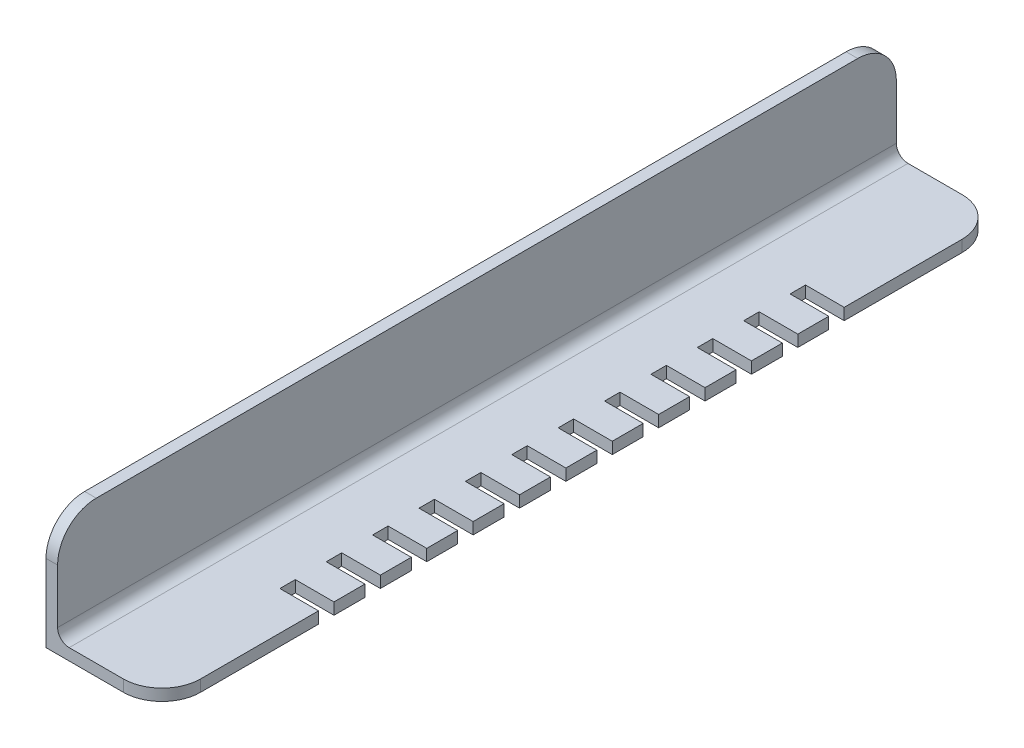
from build123d import *

# Parameters (mm, degrees)
EXTRUDE_1_DEPTH            = 217
FILLET_1_R                 = 20
SKETCH_4_W                 = 20
SKETCH_4_H                 = 8
CUT_EXTRUDE_3_DEPTH        = 10
PATTERN_LINEAR_1_COUNT     = 6
PATTERN_LINEAR_1_PITCH     = 24
PATTERN_LINEAR_1_COL_COUNT = 7
PATTERN_LINEAR_1_COL_PITCH = 24
FILLET_2_R                 = 6


with BuildPart() as part:
    # Эскиз1 → Бобышка-Вытянуть1 (new, symmetric)
    with BuildSketch(Plane.XY):
        Polygon((0, 0), (60, 0), (60, 6), (6, 6), (6, 60), (0, 60), align=None)
    extrude(amount=EXTRUDE_1_DEPTH, both=True)

    # Скругление1
    fillet_1_edges = [part.edges().sort_by_distance(p)[0] for p in [
        (60, 3, 217),
        (3, 60, 217),
        (3, 60, -217),
        (60, 3, -217),
    ]]
    fillet(fillet_1_edges, radius=FILLET_1_R)

    # Эскиз4 → Вырез-Вытянуть3 (cut)
    with BuildSketch(Plane(origin=(0, 0, 0), x_dir=(-1, 0, 0), z_dir=(0, -1, 0))):
        with Locations((-50, -12)):
            Rectangle(SKETCH_4_W, SKETCH_4_H)
    cut_extrude_3 = extrude(amount=-CUT_EXTRUDE_3_DEPTH, mode=Mode.SUBTRACT)

    # Линейный массив1: Вырез-Вытянуть3 ×6
    with Locations(*[(0, 0, i * PATTERN_LINEAR_1_PITCH) for i in range(1, PATTERN_LINEAR_1_COUNT)]):
        add(cut_extrude_3, mode=Mode.SUBTRACT)

    # Линейный массив1 col: Вырез-Вытянуть3 ×7
    with Locations(*[(0, 0, -i * PATTERN_LINEAR_1_COL_PITCH) for i in range(1, PATTERN_LINEAR_1_COL_COUNT)]):
        add(cut_extrude_3, mode=Mode.SUBTRACT)

    # Скругление2
    fillet_2_edges = [part.edges().sort_by_distance(p)[0] for p in [
        (6, 6, 0),
    ]]
    fillet(fillet_2_edges, radius=FILLET_2_R)


solid = part.part
